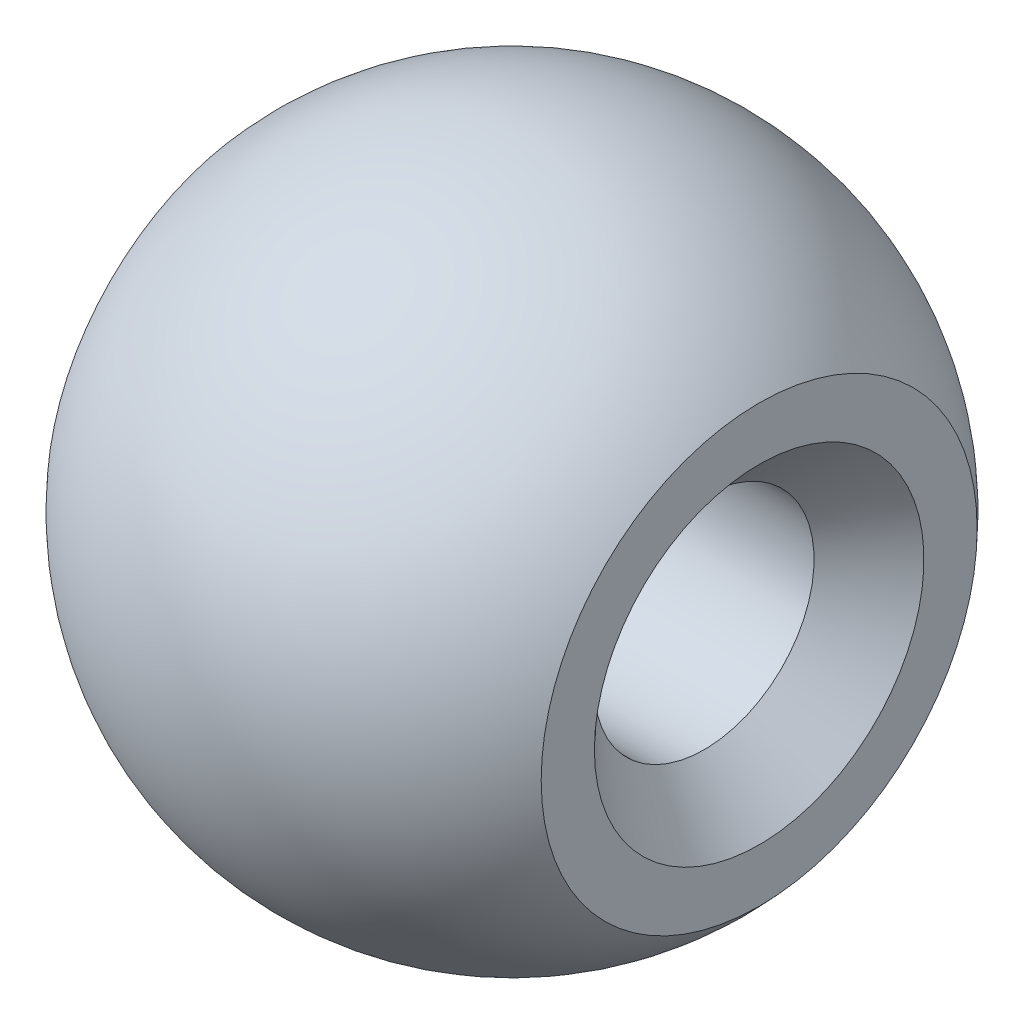
from build123d import *


with BuildPart() as part:
    # Sketch2 → Revolve1 (revolve)
    with BuildSketch(Plane.XY, mode=Mode.PRIVATE) as revolve1_sk:
        with BuildLine():
            Line((4.5, 3.968626967), (-4.5, 3.968626967))
            ThreePointArc((-4.5, 3.968626967), (0, 6), (4.5, 3.968626967))
        make_face()
        Polygon((3.5, 2), (-4.5, 2), (-4.5, 3.968626967), (4.5, 3.968626967), (4.5, 3), align=None)
    revolve(revolve1_sk.sketch.rotate(Axis((-6, 0, 0), (1, 0, 0)), 90), axis=Axis((-6, 0, 0), (1, 0, 0)))


solid = part.part
